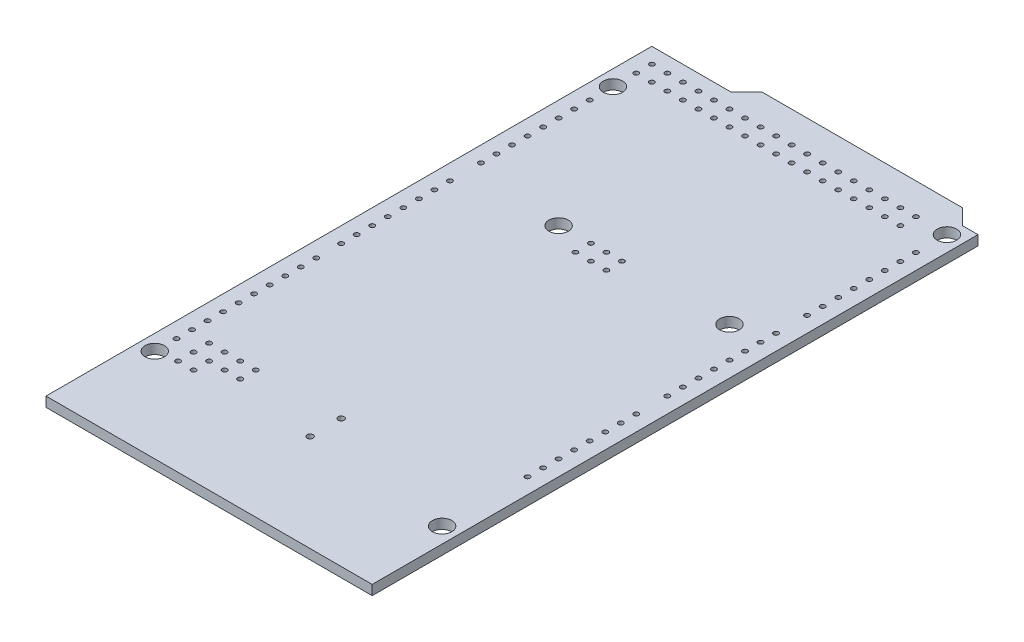
from build123d import *

# Parameters (mm, degrees)
SKETCH1_R           = 1.5875
BOSS_EXTRUDE1_DEPTH = 1.6
SKETCH2_R           = 0.4
CUT_EXTRUDE1_DEPTH  = 1.65
SKETCH3_R           = 0.4
CUT_EXTRUDE2_DEPTH  = 1.65
LPATTERN1_COUNT     = 26
LPATTERN1_PITCH     = 2.54
SKETCH4_R           = 0.4
CUT_EXTRUDE3_DEPTH  = 1.65
LPATTERN2_COUNT     = 10
LPATTERN2_PITCH     = 2.54
LPATTERN3_COUNT     = 17
LPATTERN3_PITCH     = 2.54
SKETCH5_R           = 0.4
SKETCH5_R_2         = 0.5
CUT_EXTRUDE4_DEPTH  = 10
SKETCH7_R           = 0.4
CUT_EXTRUDE6_DEPTH  = 10
LPATTERN4_COUNT     = 18
LPATTERN4_PITCH     = 2.54


with BuildPart() as part:
    # Sketch1 → Boss-Extrude1 (new body)
    with BuildSketch(Plane(origin=(0, 0, 0), x_dir=(1, 0, 0), z_dir=(0, 1, 0))):
        Polygon((0, 0), (-53.34, 0), (-53.34, 99.06), (-40.386, 99.06), (-37.846, 101.6), (-5.08, 101.6), (-2.54, 99.06), (0, 99.06), align=None)
        with Locations(Location((-7.62, 66.04, 0), (0, 0, 270))):
            Circle(SKETCH1_R, mode=Mode.SUBTRACT)
        with Locations(Location((-35.56, 66.04, 0), (0, 0, 270))):
            Circle(SKETCH1_R, mode=Mode.SUBTRACT)
        with Locations(Location((-2.54, 13.97, 0), (0, 0, 270))):
            Circle(SKETCH1_R, mode=Mode.SUBTRACT)
        with Locations(Location((-50.8, 15.24, 0), (0, 0, 270))):
            Circle(SKETCH1_R, mode=Mode.SUBTRACT)
        with Locations(Location((-2.54, 96.52, 0), (0, 0, 270))):
            Circle(SKETCH1_R, mode=Mode.SUBTRACT)
        with Locations(Location((-50.8, 90.17, 0), (0, 0, 270))):
            Circle(SKETCH1_R, mode=Mode.SUBTRACT)
    extrude(amount=-BOSS_EXTRUDE1_DEPTH)

    # Sketch2 → Cut-Extrude1 (cut)
    with BuildSketch(Plane(origin=(0, 0, 0), x_dir=(1, 0, 0), z_dir=(0, 1, 0))):
        with Locations(Location((-2.54, 27.94, 0), (0, 0, 270))):
            Circle(SKETCH2_R)
    cut_extrude1 = extrude(amount=-CUT_EXTRUDE1_DEPTH, mode=Mode.SUBTRACT)

    # Sketch3 → Cut-Extrude2 (cut)
    with BuildSketch(Plane(origin=(0, 0, 0), x_dir=(1, 0, 0), z_dir=(0, 1, 0))):
        with Locations(Location((-50.8, 18.796, 0), (0, 0, 270))):
            Circle(SKETCH3_R)
    cut_extrude2 = extrude(amount=-CUT_EXTRUDE2_DEPTH, mode=Mode.SUBTRACT)

    # LPattern1: Cut-Extrude1 ×26, 2 skipped
    with Locations(*[(0, 0, -i * LPATTERN1_PITCH) for i in range(1, LPATTERN1_COUNT) if i not in (8, 17)]):
        add(cut_extrude1, mode=Mode.SUBTRACT)

    # Sketch4 → Cut-Extrude3 (cut)
    with BuildSketch(Plane(origin=(0, 0, 0), x_dir=(1, 0, 0), z_dir=(0, 1, 0))):
        with Locations(Location((-50.8, 45.72, 0), (0, 0, 270))):
            Circle(SKETCH4_R)
    cut_extrude3 = extrude(amount=-CUT_EXTRUDE3_DEPTH, mode=Mode.SUBTRACT)

    # LPattern2: Cut-Extrude2 ×10
    with Locations(*[(0, 0, -i * LPATTERN2_PITCH) for i in range(1, LPATTERN2_COUNT)]):
        add(cut_extrude2, mode=Mode.SUBTRACT)

    # LPattern3: Cut-Extrude3 ×17, 1 skipped
    with Locations(*[(0, 0, -i * LPATTERN3_PITCH) for i in range(1, LPATTERN3_COUNT) if i not in (8,)]):
        add(cut_extrude3, mode=Mode.SUBTRACT)

    # Sketch5 → Cut-Extrude4 (cut)
    with BuildSketch(Plane(origin=(0, 0, 0), x_dir=(1, 0, 0), z_dir=(0, 1, 0))):
        with Locations(Location((-30.43, 66.18, 0), (0, 0, 270))):
            Circle(SKETCH5_R)
        with Locations(Location((-27.89, 66.18, 0), (0, 0, 270))):
            Circle(SKETCH5_R)
        with Locations(Location((-25.35, 66.18, 0), (0, 0, 270))):
            Circle(SKETCH5_R)
        with Locations(Location((-25.35, 63.64, 0), (0, 0, 270))):
            Circle(SKETCH5_R)
        with Locations(Location((-27.89, 63.64, 0), (0, 0, 270))):
            Circle(SKETCH5_R)
        with Locations(Location((-30.43, 63.64, 0), (0, 0, 270))):
            Circle(SKETCH5_R)
        with Locations(Location((-47.498, 15.748, 0), (0, 0, 270))):
            Circle(SKETCH5_R)
        with Locations(Location((-47.498, 18.288, 0), (0, 0, 270))):
            Circle(SKETCH5_R)
        with Locations(Location((-47.498, 20.828, 0), (0, 0, 270))):
            Circle(SKETCH5_R)
        with Locations(Location((-44.958, 20.828, 0), (0, 0, 270))):
            Circle(SKETCH5_R)
        with Locations(Location((-44.958, 18.288, 0), (0, 0, 270))):
            Circle(SKETCH5_R)
        with Locations(Location((-44.958, 15.748, 0), (0, 0, 270))):
            Circle(SKETCH5_R)
        with Locations(Location((-42.418, 18.288, 0), (0, 0, 270))):
            Circle(SKETCH5_R)
        with Locations(Location((-42.418, 20.828, 0), (0, 0, 270))):
            Circle(SKETCH5_R)
        with Locations(Location((-39.878, 20.828, 0), (0, 0, 270))):
            Circle(SKETCH5_R)
        with Locations(Location((-39.878, 18.288, 0), (0, 0, 270))):
            Circle(SKETCH5_R)
        with Locations(Location((-26.035, 20.955, 0), (0, 0, 270))):
            Circle(SKETCH5_R_2)
        with Locations(Location((-26.035, 15.875, 0), (0, 0, 270))):
            Circle(SKETCH5_R_2)
    extrude(amount=-CUT_EXTRUDE4_DEPTH, mode=Mode.SUBTRACT)

    # Sketch7 → Cut-Extrude6 (cut)
    with BuildSketch(Plane(origin=(0, 0, 0), x_dir=(1, 0, 0), z_dir=(0, 1, 0))):
        with Locations(Location((-50.8, 96.52, 0), (0, 0, 270))):
            Circle(SKETCH7_R)
        with Locations(Location((-50.8, 93.98, 0), (0, 0, 270))):
            Circle(SKETCH7_R)
    cut_extrude6 = extrude(amount=-CUT_EXTRUDE6_DEPTH, mode=Mode.SUBTRACT)

    # LPattern4: Cut-Extrude6 ×18
    with Locations(*[(i * LPATTERN4_PITCH, 0, 0) for i in range(1, LPATTERN4_COUNT)]):
        add(cut_extrude6, mode=Mode.SUBTRACT)


solid = part.part
